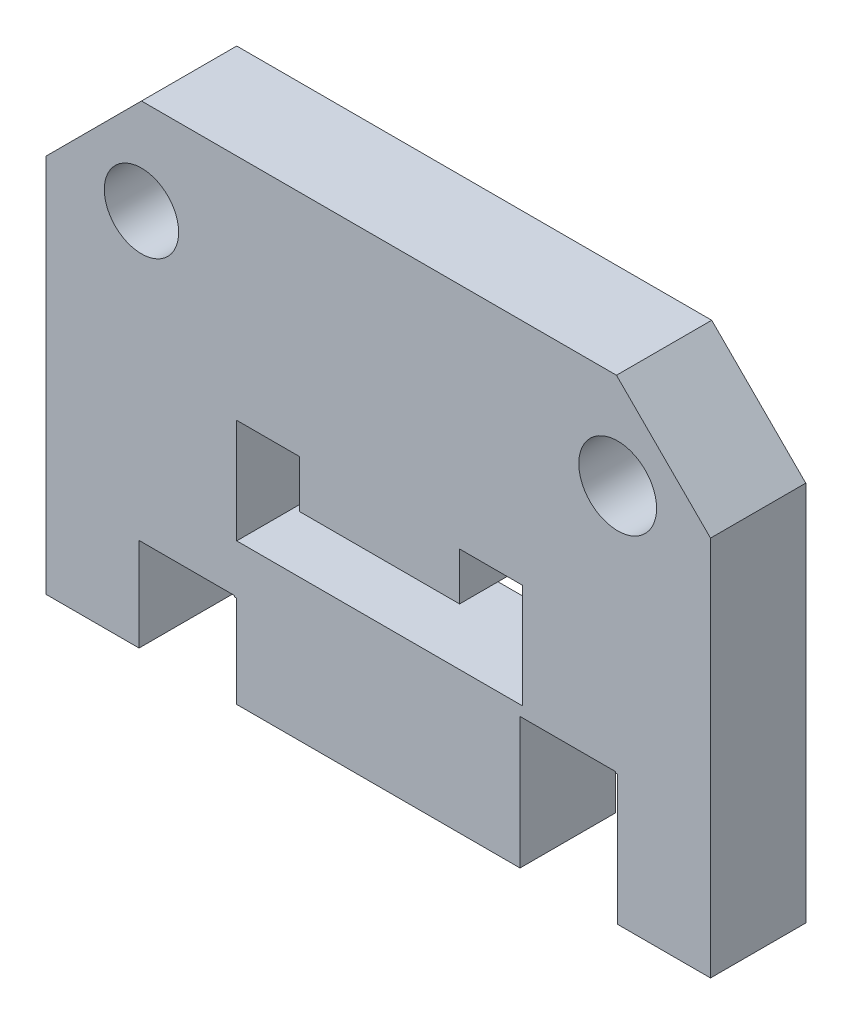
from build123d import *

# Parameters (mm, degrees)
SKETCH1_R           = 3.903170007
SKETCH1_R_2         = 4.085841865
BOSS_EXTRUDE1_DEPTH = 5


with BuildPart() as part:
    # Sketch1 → Boss-Extrude1 (new, symmetric)
    with BuildSketch(Plane.XY):
        Polygon((24.873664066, 25), (-25, 25), (-35, 15), (-35, -24.873664066), (-25.252671867, -24.873664066), (-25.252671867, -15.08356524), (-15.252671867, -15.08356524), (-15.252671867, -15.209901174), (-15, -15.209901174), (-15, -24.873664066), (14.747328133, -24.873664066), (14.747328133, -11.089222254), (24.747328133, -11.089222254), (24.747328133, -11.215558187), (25, -11.215558187), (25, -24.873664066), (34.747328133, -24.873664066), (34.747328133, 15.126335934), align=None)
        Polygon((15, -10), (-15, -10), (-15, 0.964343272), (-8.398565663, 0.964343272), (-8.398565663, -4.035656728), (8.398565663, -4.035656728), (8.398565663, 0.964343272), (15, 0.964343272), align=None, mode=Mode.SUBTRACT)
        with Locations((-25, 15)):
            Circle(SKETCH1_R, mode=Mode.SUBTRACT)
        with Locations((25, 15)):
            Circle(SKETCH1_R_2, mode=Mode.SUBTRACT)
    extrude(amount=BOSS_EXTRUDE1_DEPTH, both=True)


solid = part.part
